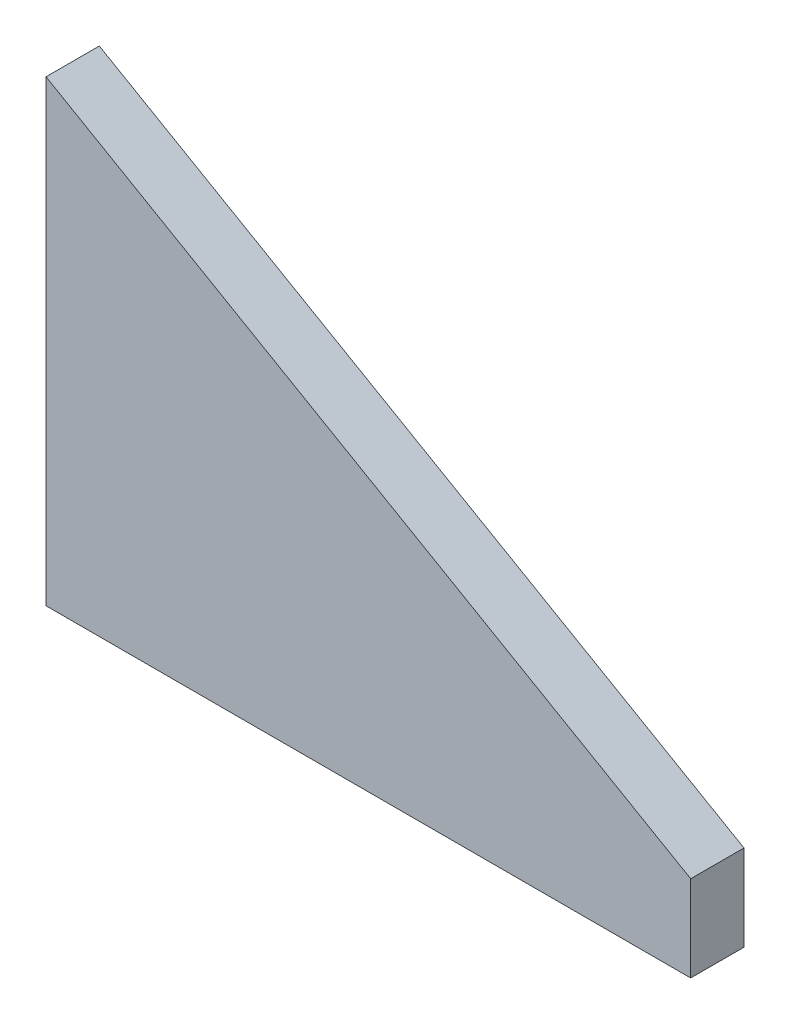
from build123d import *

# Parameters (mm, degrees)
EXTRUDE1_DEPTH = 0.7874


with BuildPart() as part:
    # Sketch1 → Extrude1 (new, symmetric)
    with BuildSketch(Plane.XY):
        Polygon((-9.525, 4.0132), (9.525, -6.985), (9.525, -9.525), (-9.525, -9.525), (-9.525, -6.985), align=None)
    extrude(amount=EXTRUDE1_DEPTH, both=True)


solid = part.part
